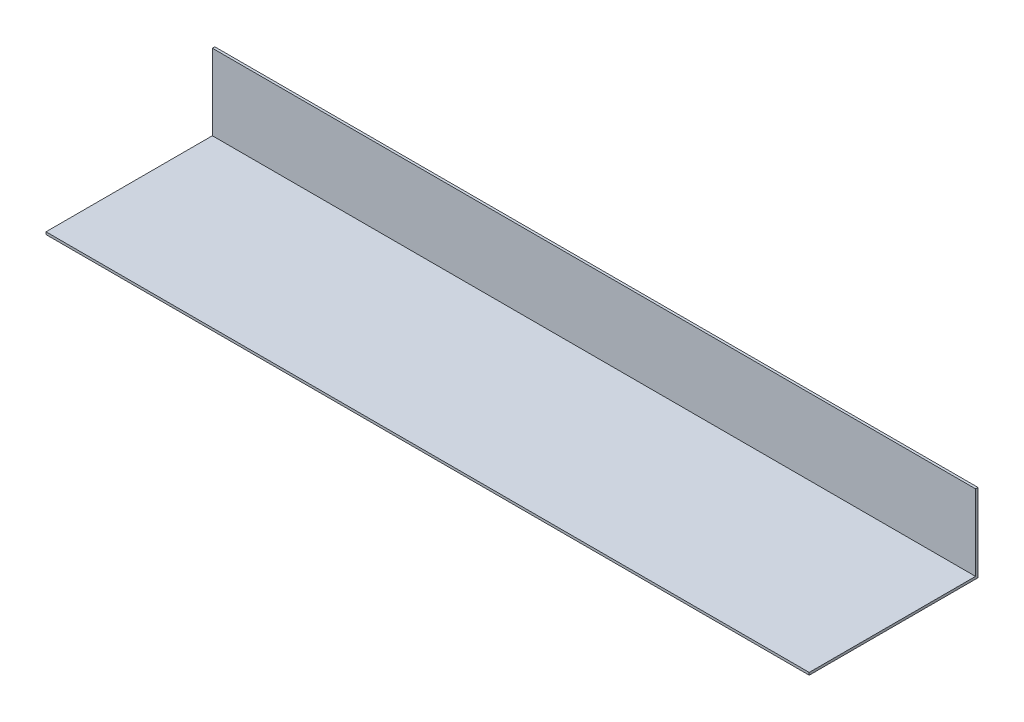
from build123d import *

# Parameters (mm, degrees)
SKETCH1_W           = 495.3
SKETCH1_H           = 50.8
BOSS_EXTRUDE1_DEPTH = 1.5875
SKETCH2_W           = 495.3
SKETCH2_H           = 1.5875
BOSS_EXTRUDE2_DEPTH = 107.95


with BuildPart() as part:
    # Sketch1 → Boss-Extrude1 (new body)
    with BuildSketch(Plane.XY):
        Rectangle(SKETCH1_W, SKETCH1_H)
    extrude(amount=BOSS_EXTRUDE1_DEPTH)

    # Sketch2 → Boss-Extrude2 (add)
    with BuildSketch(Plane.XY.offset(1.5875)):
        with Locations((0, -24.60625)):
            Rectangle(SKETCH2_W, SKETCH2_H)
    extrude(amount=BOSS_EXTRUDE2_DEPTH)


solid = part.part
